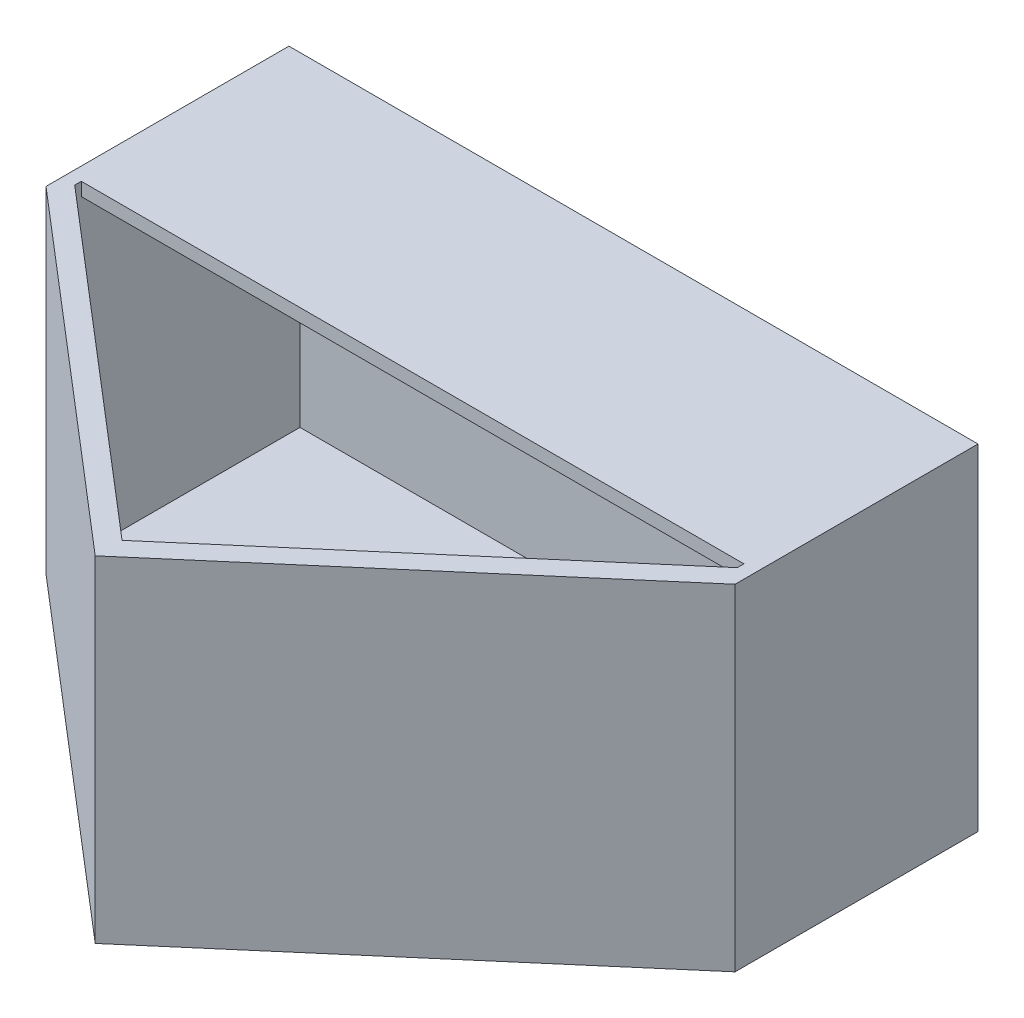
from build123d import *

# Parameters (mm, degrees)
SKETCH1_W           = 1560
SKETCH1_H           = 760
SKETCH1_W_2         = 1500
SKETCH1_H_2         = 700
BOSS_EXTRUDE1_DEPTH = 500
SKETCH2_W           = 1500
SKETCH2_H           = 700
BOSS_EXTRUDE2_DEPTH = 5
SKETCH5_W           = 30
SKETCH5_H           = 760
BOSS_EXTRUDE3_DEPTH = 50
CUT_EXTRUDE1_REACH  = 1260.086
SKETCH7_W           = 46.097722286
SKETCH7_H           = 760
BOSS_EXTRUDE4_DEPTH = 1709
SKETCH8_W           = 30
SKETCH8_H           = 760
BOSS_EXTRUDE5_DEPTH = 50
CUT_EXTRUDE2_REACH  = 2012.771
BOSS_EXTRUDE6_REACH = 2092.258
SKETCH11_W          = 46.097722286
SKETCH11_H          = 760
CUT_EXTRUDE4_DEPTH  = 1023
CUT_EXTRUDE5_DEPTH  = 1023
BOSS_EXTRUDE7_REACH = 1199.247
SKETCH14_W          = 1500
SKETCH14_H          = 30


with BuildPart() as part:
    # Sketch1 → Boss-Extrude1 (new body)
    with BuildSketch(Plane.XY):
        with Locations((58.260712741, 83.006069765)):
            Rectangle(SKETCH1_W, SKETCH1_H)
        with Locations((58.260712741, 83.006069765)):
            Rectangle(SKETCH1_W_2, SKETCH1_H_2, mode=Mode.SUBTRACT)
    extrude(amount=BOSS_EXTRUDE1_DEPTH)

    # Sketch2 → Boss-Extrude2 (add)
    with BuildSketch(Plane.XY):
        with Locations((58.260712741, 83.006069765)):
            Rectangle(SKETCH2_W, SKETCH2_H)
    extrude(amount=BOSS_EXTRUDE2_DEPTH)

    # Sketch5 → Boss-Extrude3 (add)
    with BuildSketch(Plane.XY.offset(500)):
        with Locations((823.260712741, 83.006069765)):
            Rectangle(SKETCH5_W, SKETCH5_H)
    extrude(amount=BOSS_EXTRUDE3_DEPTH)

    # Sketch6 → Cut-Extrude1 (cut, up to next)
    with BuildSketch(Plane(origin=(0, 463.006069765, 0), x_dir=(1, 0, 0), z_dir=(0, 1, 0)), mode=Mode.PRIVATE) as cut_extrude1_sk1:
        Polygon((838.260712741, -550), (808.260712741, -515), (808.260712741, -550), align=None)
    cut_extrude1_tool1 = extrude(cut_extrude1_sk1.sketch, amount=-CUT_EXTRUDE1_REACH, mode=Mode.PRIVATE) & part.part
    add(cut_extrude1_tool1.solids().sort_by_distance((818.260713, 463.00607, 538.333333))[0], mode=Mode.SUBTRACT)

    # Sketch7 → Boss-Extrude4 (add)
    with BuildSketch(Plane(origin=(211.467940286, 0, -181.258234531), x_dir=(0.6507913734559673, 0, 0.7592566023652978), z_dir=(-0.7592566023652978, 0, 0.6507913734559673))):
        with Locations((940.075110717, 83.006069765)):
            Rectangle(SKETCH7_W, SKETCH7_H)
    extrude(amount=BOSS_EXTRUDE4_DEPTH)

    # Sketch8 → Boss-Extrude5 (add)
    with BuildSketch(Plane.XY.offset(500)):
        with Locations((-706.739287259, 83.006069765)):
            Rectangle(SKETCH8_W, SKETCH8_H)
    extrude(amount=BOSS_EXTRUDE5_DEPTH)

    # Sketch10 → Cut-Extrude2 (cut, up to next)
    with BuildSketch(Plane(origin=(0, 463.006069765, 0), x_dir=(1, 0, 0), z_dir=(0, 1, 0)), mode=Mode.PRIVATE) as cut_extrude2_sk1:
        Polygon((-691.739287259, -550), (-691.739287259, -515), (-721.739287259, -550), align=None)
    cut_extrude2_tool1 = extrude(cut_extrude2_sk1.sketch, amount=-CUT_EXTRUDE2_REACH, mode=Mode.PRIVATE) & part.part
    add(cut_extrude2_tool1.solids().sort_by_distance((-701.739287, 463.00607, 538.333333))[0], mode=Mode.SUBTRACT)

    # Boss-Extrude6: up to this plane
    boss_extrude6_end = Plane(origin=(-489.308820701, 463.006069765, 1627.202457236), z_dir=(0.6507913734559673, 0, 0.7592566023652978))
    # Sketch11 → Boss-Extrude6 (add, up to the surface)
    with BuildSketch(Plane(origin=(-144.296765596, 0, -123.682941939), x_dir=(0.6507913734559686, 0, -0.7592566023652966), z_dir=(0.7592566023652966, 0, 0.6507913734559686)), mode=Mode.PRIVATE) as boss_extrude6_sk1:
        with Locations((-864.24397219, 83.006069765)):
            Rectangle(SKETCH11_W, SKETCH11_H)
    boss_extrude6_tool1 = split(extrude(boss_extrude6_sk1.sketch, amount=BOSS_EXTRUDE6_REACH, mode=Mode.PRIVATE), bisect_by=boss_extrude6_end, keep=Keep.BOTH, mode=Mode.PRIVATE)
    add(boss_extrude6_tool1.solids().sort_by_distance((-706.739287, 83.00607, 532.5))[0])

    # Sketch12 → Cut-Extrude4 (cut)
    with BuildSketch(Plane(origin=(0, 463.006069765, 0), x_dir=(1, 0, 0), z_dir=(0, 1, 0))):
        Polygon((55.536353767, -1220.906593407), (-459.308820701, -1662.202457236), (-489.308820701, -1627.202457236), (22.844046075, -1188.214285714), align=None)
    extrude(amount=-CUT_EXTRUDE4_DEPTH, mode=Mode.SUBTRACT)

    # Sketch13 → Cut-Extrude5 (cut)
    with BuildSketch(Plane(origin=(0, 463.006069765, 0), x_dir=(1, 0, 0), z_dir=(0, 1, 0))):
        Polygon((22.844046075, -1188.214285714), (58.260712741, -1218.571428571), (55.536353767, -1220.906593407), align=None)
    extrude(amount=-CUT_EXTRUDE5_DEPTH, mode=Mode.SUBTRACT)

    # Sketch14 → Boss-Extrude7 (add, up to next)
    with BuildSketch(Plane.XY.offset(500), mode=Mode.PRIVATE) as boss_extrude7_sk1:
        with Locations((58.260712741, -281.993930235)):
            Rectangle(SKETCH14_W, SKETCH14_H)
    boss_extrude7_tool1 = extrude(boss_extrude7_sk1.sketch, amount=BOSS_EXTRUDE7_REACH, mode=Mode.PRIVATE) - part.part
    add(boss_extrude7_tool1.solids().sort_by_distance((58.260713, -281.99393, 500))[0])


solid = part.part
